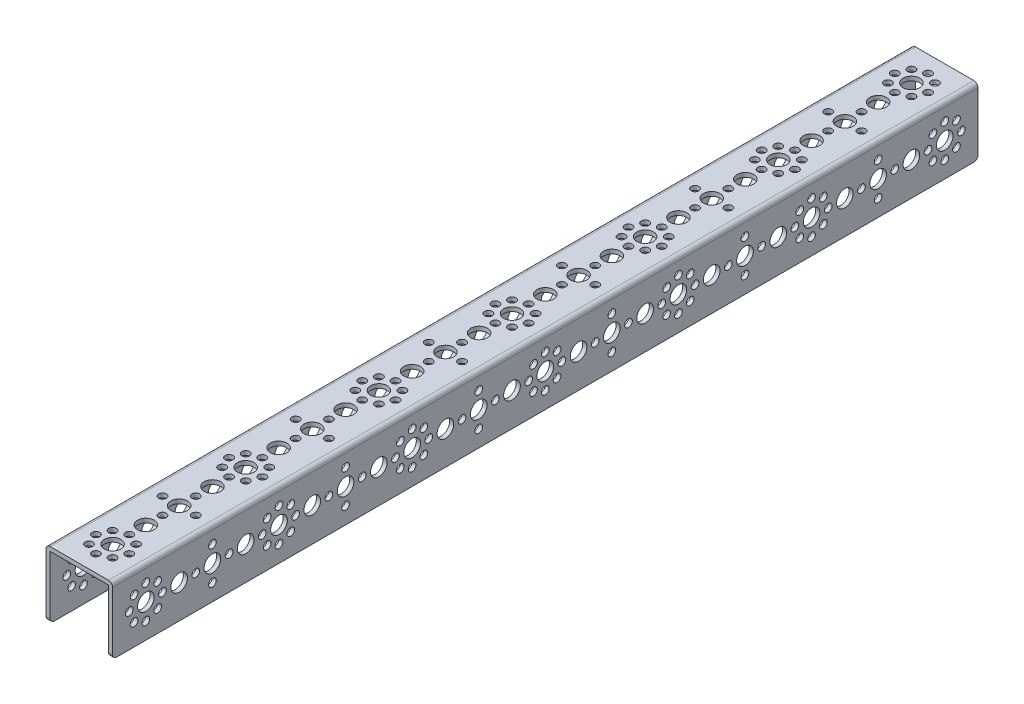
from build123d import *

# Parameters (mm, degrees)
BOSS_EXTRUDE1_DEPTH = 416
SKETCH2_R           = 4
SKETCH2_R_2         = 1.85
CUT_EXTRUDE1_DEPTH  = 418.535627222
SKETCH3_R           = 4
SKETCH3_R_2         = 1.85
CUT_EXTRUDE2_DEPTH  = 418.535627222
FILLET1_R           = 2


with BuildPart() as part:
    # Sketch1 → Boss-Extrude1 (new body)
    with BuildSketch(Plane.XY):
        Polygon((14, -16), (16, -16), (16, 16), (-16, 16), (-16, -16), (-14, -16), (-14, 14), (14, 14), align=None)
    extrude(amount=-BOSS_EXTRUDE1_DEPTH)

    # Sketch2 → Cut-Extrude1 (cut, through all)
    with BuildSketch(Plane(origin=(0, 16, 0), x_dir=(1, 0, 0), z_dir=(0, 1, 0))):
        with Locations(Location((0, 256, 0), (0, 0, 270))):
            Circle(SKETCH2_R)
        with Locations(Location((0, 224, 0), (0, 0, 270))):
            Circle(SKETCH2_R)
        with Locations(Location((0.175415159, 192, 0), (0, 0, 270))):
            Circle(SKETCH2_R)
        with Locations(Location((0, 160, 0), (0, 0, 270))):
            Circle(SKETCH2_R)
        with Locations(Location((0, 240, 0), (0, 0, 270))):
            Circle(SKETCH2_R)
        with Locations(Location((0, 232, 0), (0, 0, 270))):
            Circle(SKETCH2_R_2)
        with Locations(Location((0, 248, 0), (0, 0, 270))):
            Circle(SKETCH2_R_2)
        with Locations(Location((-8, 240, 0), (0, 0, 270))):
            Circle(SKETCH2_R_2)
        with Locations(Location((8, 240, 0), (0, 0, 270))):
            Circle(SKETCH2_R_2)
        with Locations(Location((0, 264, 0), (0, 0, 270))):
            Circle(SKETCH2_R_2)
        with Locations(Location((-8, 272, 0), (0, 0, 270))):
            Circle(SKETCH2_R_2)
        with Locations(Location((0, 272, 0), (0, 0, 270))):
            Circle(SKETCH2_R)
        with Locations(Location((8, 272, 0), (0, 0, 270))):
            Circle(SKETCH2_R_2)
        with Locations(Location((5.66, 277.66, 0), (0, 0, 270))):
            Circle(SKETCH2_R_2)
        with Locations(Location((-5.66, 277.66, 0), (0, 0, 270))):
            Circle(SKETCH2_R_2)
        with Locations(Location((0, 280, 0), (0, 0, 270))):
            Circle(SKETCH2_R_2)
        with Locations(Location((5.66, 266.34, 0), (0, 0, 270))):
            Circle(SKETCH2_R_2)
        with Locations(Location((-5.66, 266.34, 0), (0, 0, 270))):
            Circle(SKETCH2_R_2)
        with Locations(Location((0, 176, 0), (0, 0, 270))):
            Circle(SKETCH2_R)
        with Locations(Location((0, 168, 0), (0, 0, 270))):
            Circle(SKETCH2_R_2)
        with Locations(Location((0, 184, 0), (0, 0, 270))):
            Circle(SKETCH2_R_2)
        with Locations(Location((-8, 176, 0), (0, 0, 270))):
            Circle(SKETCH2_R_2)
        with Locations(Location((8, 176, 0), (0, 0, 270))):
            Circle(SKETCH2_R_2)
        with Locations(Location((0, 200, 0), (0, 0, 270))):
            Circle(SKETCH2_R_2)
        with Locations(Location((-8, 208, 0), (0, 0, 270))):
            Circle(SKETCH2_R_2)
        with Locations(Location((0, 208, 0), (0, 0, 270))):
            Circle(SKETCH2_R)
        with Locations(Location((8, 208, 0), (0, 0, 270))):
            Circle(SKETCH2_R_2)
        with Locations(Location((5.66, 213.66, 0), (0, 0, 270))):
            Circle(SKETCH2_R_2)
        with Locations(Location((-5.66, 213.66, 0), (0, 0, 270))):
            Circle(SKETCH2_R_2)
        with Locations(Location((0, 216, 0), (0, 0, 270))):
            Circle(SKETCH2_R_2)
        with Locations(Location((5.66, 202.34, 0), (0, 0, 270))):
            Circle(SKETCH2_R_2)
        with Locations(Location((-5.66, 202.34, 0), (0, 0, 270))):
            Circle(SKETCH2_R_2)
        with Locations(Location((0, 32, 0), (0, 0, 270))):
            Circle(SKETCH2_R)
        with Locations(Location((0, 64, 0), (0, 0, 270))):
            Circle(SKETCH2_R)
        with Locations(Location((-0.175415159, 96, 0), (0, 0, 270))):
            Circle(SKETCH2_R)
        with Locations(Location((0, 128, 0), (0, 0, 270))):
            Circle(SKETCH2_R)
        with Locations(Location((0, 48, 0), (0, 0, 270))):
            Circle(SKETCH2_R)
        with Locations(Location((0, 56, 0), (0, 0, 270))):
            Circle(SKETCH2_R_2)
        with Locations(Location((0, 40, 0), (0, 0, 270))):
            Circle(SKETCH2_R_2)
        with Locations(Location((8, 48, 0), (0, 0, 270))):
            Circle(SKETCH2_R_2)
        with Locations(Location((-8, 48, 0), (0, 0, 270))):
            Circle(SKETCH2_R_2)
        with Locations(Location((0, 24, 0), (0, 0, 270))):
            Circle(SKETCH2_R_2)
        with Locations(Location((8, 16, 0), (0, 0, 270))):
            Circle(SKETCH2_R_2)
        with Locations(Location((0, 16, 0), (0, 0, 270))):
            Circle(SKETCH2_R)
        with Locations(Location((-8, 16, 0), (0, 0, 270))):
            Circle(SKETCH2_R_2)
        with Locations(Location((-5.66, 10.34, 0), (0, 0, 270))):
            Circle(SKETCH2_R_2)
        with Locations(Location((5.66, 10.34, 0), (0, 0, 270))):
            Circle(SKETCH2_R_2)
        with Locations(Location((0, 8, 0), (0, 0, 270))):
            Circle(SKETCH2_R_2)
        with Locations(Location((-5.66, 21.66, 0), (0, 0, 270))):
            Circle(SKETCH2_R_2)
        with Locations(Location((5.66, 21.66, 0), (0, 0, 270))):
            Circle(SKETCH2_R_2)
        with Locations(Location((0, 112, 0), (0, 0, 270))):
            Circle(SKETCH2_R)
        with Locations(Location((0, 120, 0), (0, 0, 270))):
            Circle(SKETCH2_R_2)
        with Locations(Location((0, 104, 0), (0, 0, 270))):
            Circle(SKETCH2_R_2)
        with Locations(Location((8, 112, 0), (0, 0, 270))):
            Circle(SKETCH2_R_2)
        with Locations(Location((-8, 112, 0), (0, 0, 270))):
            Circle(SKETCH2_R_2)
        with Locations(Location((0, 88, 0), (0, 0, 270))):
            Circle(SKETCH2_R_2)
        with Locations(Location((8, 80, 0), (0, 0, 270))):
            Circle(SKETCH2_R_2)
        with Locations(Location((0, 80, 0), (0, 0, 270))):
            Circle(SKETCH2_R)
        with Locations(Location((-8, 80, 0), (0, 0, 270))):
            Circle(SKETCH2_R_2)
        with Locations(Location((-5.66, 74.34, 0), (0, 0, 270))):
            Circle(SKETCH2_R_2)
        with Locations(Location((5.66, 74.34, 0), (0, 0, 270))):
            Circle(SKETCH2_R_2)
        with Locations(Location((0, 72, 0), (0, 0, 270))):
            Circle(SKETCH2_R_2)
        with Locations(Location((-5.66, 85.66, 0), (0, 0, 270))):
            Circle(SKETCH2_R_2)
        with Locations(Location((5.66, 85.66, 0), (0, 0, 270))):
            Circle(SKETCH2_R_2)
        with Locations(Location((0, 136, 0), (0, 0, 270))):
            Circle(SKETCH2_R_2)
        with Locations(Location((-8, 144, 0), (0, 0, 270))):
            Circle(SKETCH2_R_2)
        with Locations(Location((0, 144, 0), (0, 0, 270))):
            Circle(SKETCH2_R)
        with Locations(Location((8, 144, 0), (0, 0, 270))):
            Circle(SKETCH2_R_2)
        with Locations(Location((5.66, 149.66, 0), (0, 0, 270))):
            Circle(SKETCH2_R_2)
        with Locations(Location((-5.66, 149.66, 0), (0, 0, 270))):
            Circle(SKETCH2_R_2)
        with Locations(Location((0, 152, 0), (0, 0, 270))):
            Circle(SKETCH2_R_2)
        with Locations(Location((5.66, 138.34, 0), (0, 0, 270))):
            Circle(SKETCH2_R_2)
        with Locations(Location((-5.66, 138.34, 0), (0, 0, 270))):
            Circle(SKETCH2_R_2)
        with Locations(Location((0, 384, 0), (0, 0, 270))):
            Circle(SKETCH2_R)
        with Locations(Location((0, 352, 0), (0, 0, 270))):
            Circle(SKETCH2_R)
        with Locations(Location((0.175415159, 320, 0), (0, 0, 270))):
            Circle(SKETCH2_R)
        with Locations(Location((0, 288, 0), (0, 0, 270))):
            Circle(SKETCH2_R)
        with Locations(Location((0, 368, 0), (0, 0, 270))):
            Circle(SKETCH2_R)
        with Locations(Location((0, 360, 0), (0, 0, 270))):
            Circle(SKETCH2_R_2)
        with Locations(Location((0, 376, 0), (0, 0, 270))):
            Circle(SKETCH2_R_2)
        with Locations(Location((-8, 368, 0), (0, 0, 270))):
            Circle(SKETCH2_R_2)
        with Locations(Location((8, 368, 0), (0, 0, 270))):
            Circle(SKETCH2_R_2)
        with Locations(Location((0, 392, 0), (0, 0, 270))):
            Circle(SKETCH2_R_2)
        with Locations(Location((-8, 400, 0), (0, 0, 270))):
            Circle(SKETCH2_R_2)
        with Locations(Location((0, 400, 0), (0, 0, 270))):
            Circle(SKETCH2_R)
        with Locations(Location((8, 400, 0), (0, 0, 270))):
            Circle(SKETCH2_R_2)
        with Locations(Location((5.66, 405.66, 0), (0, 0, 270))):
            Circle(SKETCH2_R_2)
        with Locations(Location((-5.66, 405.66, 0), (0, 0, 270))):
            Circle(SKETCH2_R_2)
        with Locations(Location((0, 408, 0), (0, 0, 270))):
            Circle(SKETCH2_R_2)
        with Locations(Location((5.66, 394.34, 0), (0, 0, 270))):
            Circle(SKETCH2_R_2)
        with Locations(Location((-5.66, 394.34, 0), (0, 0, 270))):
            Circle(SKETCH2_R_2)
        with Locations(Location((0, 304, 0), (0, 0, 270))):
            Circle(SKETCH2_R)
        with Locations(Location((0, 296, 0), (0, 0, 270))):
            Circle(SKETCH2_R_2)
        with Locations(Location((0, 312, 0), (0, 0, 270))):
            Circle(SKETCH2_R_2)
        with Locations(Location((-8, 304, 0), (0, 0, 270))):
            Circle(SKETCH2_R_2)
        with Locations(Location((8, 304, 0), (0, 0, 270))):
            Circle(SKETCH2_R_2)
        with Locations(Location((0, 328, 0), (0, 0, 270))):
            Circle(SKETCH2_R_2)
        with Locations(Location((-8, 336, 0), (0, 0, 270))):
            Circle(SKETCH2_R_2)
        with Locations(Location((0, 336, 0), (0, 0, 270))):
            Circle(SKETCH2_R)
        with Locations(Location((8, 336, 0), (0, 0, 270))):
            Circle(SKETCH2_R_2)
        with Locations(Location((5.66, 341.66, 0), (0, 0, 270))):
            Circle(SKETCH2_R_2)
        with Locations(Location((-5.66, 341.66, 0), (0, 0, 270))):
            Circle(SKETCH2_R_2)
        with Locations(Location((0, 344, 0), (0, 0, 270))):
            Circle(SKETCH2_R_2)
        with Locations(Location((5.66, 330.34, 0), (0, 0, 270))):
            Circle(SKETCH2_R_2)
        with Locations(Location((-5.66, 330.34, 0), (0, 0, 270))):
            Circle(SKETCH2_R_2)
    extrude(amount=-CUT_EXTRUDE1_DEPTH, mode=Mode.SUBTRACT)

    # Sketch3 → Cut-Extrude2 (cut, through all)
    with BuildSketch(Plane(origin=(16, 0, 0), x_dir=(0, 0, -1), z_dir=(1, 0, 0))):
        with Locations(Location((160, 0, 0), (0, 0, 90))):
            Circle(SKETCH3_R)
        with Locations(Location((192, 0, 0), (0, 0, 90))):
            Circle(SKETCH3_R)
        with Locations(Location((224, 0.175415159, 0), (0, 0, 90))):
            Circle(SKETCH3_R)
        with Locations(Location((256, 0, 0), (0, 0, 90))):
            Circle(SKETCH3_R)
        with Locations(Location((176, 0, 0), (0, 0, 90))):
            Circle(SKETCH3_R)
        with Locations(Location((184, 0, 0), (0, 0, 90))):
            Circle(SKETCH3_R_2)
        with Locations(Location((168, 0, 0), (0, 0, 90))):
            Circle(SKETCH3_R_2)
        with Locations(Location((176, -8, 0), (0, 0, 90))):
            Circle(SKETCH3_R_2)
        with Locations(Location((176, 8, 0), (0, 0, 90))):
            Circle(SKETCH3_R_2)
        with Locations(Location((152, 0, 0), (0, 0, 90))):
            Circle(SKETCH3_R_2)
        with Locations(Location((144, -8, 0), (0, 0, 90))):
            Circle(SKETCH3_R_2)
        with Locations(Location((144, 0, 0), (0, 0, 90))):
            Circle(SKETCH3_R)
        with Locations(Location((144, 8, 0), (0, 0, 90))):
            Circle(SKETCH3_R_2)
        with Locations(Location((138.34, 5.66, 0), (0, 0, 90))):
            Circle(SKETCH3_R_2)
        with Locations(Location((138.34, -5.66, 0), (0, 0, 90))):
            Circle(SKETCH3_R_2)
        with Locations(Location((136, 0, 0), (0, 0, 90))):
            Circle(SKETCH3_R_2)
        with Locations(Location((149.66, 5.66, 0), (0, 0, 90))):
            Circle(SKETCH3_R_2)
        with Locations(Location((149.66, -5.66, 0), (0, 0, 90))):
            Circle(SKETCH3_R_2)
        with Locations(Location((240, 0, 0), (0, 0, 90))):
            Circle(SKETCH3_R)
        with Locations(Location((248, 0, 0), (0, 0, 90))):
            Circle(SKETCH3_R_2)
        with Locations(Location((232, 0, 0), (0, 0, 90))):
            Circle(SKETCH3_R_2)
        with Locations(Location((240, -8, 0), (0, 0, 90))):
            Circle(SKETCH3_R_2)
        with Locations(Location((240, 8, 0), (0, 0, 90))):
            Circle(SKETCH3_R_2)
        with Locations(Location((216, 0, 0), (0, 0, 90))):
            Circle(SKETCH3_R_2)
        with Locations(Location((208, -8, 0), (0, 0, 90))):
            Circle(SKETCH3_R_2)
        with Locations(Location((208, 0, 0), (0, 0, 90))):
            Circle(SKETCH3_R)
        with Locations(Location((208, 8, 0), (0, 0, 90))):
            Circle(SKETCH3_R_2)
        with Locations(Location((202.34, 5.66, 0), (0, 0, 90))):
            Circle(SKETCH3_R_2)
        with Locations(Location((202.34, -5.66, 0), (0, 0, 90))):
            Circle(SKETCH3_R_2)
        with Locations(Location((200, 0, 0), (0, 0, 90))):
            Circle(SKETCH3_R_2)
        with Locations(Location((213.66, 5.66, 0), (0, 0, 90))):
            Circle(SKETCH3_R_2)
        with Locations(Location((213.66, -5.66, 0), (0, 0, 90))):
            Circle(SKETCH3_R_2)
        with Locations(Location((384, 0, 0), (0, 0, 90))):
            Circle(SKETCH3_R)
        with Locations(Location((352, 0, 0), (0, 0, 90))):
            Circle(SKETCH3_R)
        with Locations(Location((320, -0.175415159, 0), (0, 0, 90))):
            Circle(SKETCH3_R)
        with Locations(Location((288, 0, 0), (0, 0, 90))):
            Circle(SKETCH3_R)
        with Locations(Location((368, 0, 0), (0, 0, 90))):
            Circle(SKETCH3_R)
        with Locations(Location((360, 0, 0), (0, 0, 90))):
            Circle(SKETCH3_R_2)
        with Locations(Location((376, 0, 0), (0, 0, 90))):
            Circle(SKETCH3_R_2)
        with Locations(Location((368, 8, 0), (0, 0, 90))):
            Circle(SKETCH3_R_2)
        with Locations(Location((368, -8, 0), (0, 0, 90))):
            Circle(SKETCH3_R_2)
        with Locations(Location((392, 0, 0), (0, 0, 90))):
            Circle(SKETCH3_R_2)
        with Locations(Location((400, 8, 0), (0, 0, 90))):
            Circle(SKETCH3_R_2)
        with Locations(Location((400, 0, 0), (0, 0, 90))):
            Circle(SKETCH3_R)
        with Locations(Location((400, -8, 0), (0, 0, 90))):
            Circle(SKETCH3_R_2)
        with Locations(Location((405.66, -5.66, 0), (0, 0, 90))):
            Circle(SKETCH3_R_2)
        with Locations(Location((405.66, 5.66, 0), (0, 0, 90))):
            Circle(SKETCH3_R_2)
        with Locations(Location((408, 0, 0), (0, 0, 90))):
            Circle(SKETCH3_R_2)
        with Locations(Location((394.34, -5.66, 0), (0, 0, 90))):
            Circle(SKETCH3_R_2)
        with Locations(Location((394.34, 5.66, 0), (0, 0, 90))):
            Circle(SKETCH3_R_2)
        with Locations(Location((304, 0, 0), (0, 0, 90))):
            Circle(SKETCH3_R)
        with Locations(Location((296, 0, 0), (0, 0, 90))):
            Circle(SKETCH3_R_2)
        with Locations(Location((312, 0, 0), (0, 0, 90))):
            Circle(SKETCH3_R_2)
        with Locations(Location((304, 8, 0), (0, 0, 90))):
            Circle(SKETCH3_R_2)
        with Locations(Location((304, -8, 0), (0, 0, 90))):
            Circle(SKETCH3_R_2)
        with Locations(Location((328, 0, 0), (0, 0, 90))):
            Circle(SKETCH3_R_2)
        with Locations(Location((336, 8, 0), (0, 0, 90))):
            Circle(SKETCH3_R_2)
        with Locations(Location((336, 0, 0), (0, 0, 90))):
            Circle(SKETCH3_R)
        with Locations(Location((336, -8, 0), (0, 0, 90))):
            Circle(SKETCH3_R_2)
        with Locations(Location((341.66, -5.66, 0), (0, 0, 90))):
            Circle(SKETCH3_R_2)
        with Locations(Location((341.66, 5.66, 0), (0, 0, 90))):
            Circle(SKETCH3_R_2)
        with Locations(Location((344, 0, 0), (0, 0, 90))):
            Circle(SKETCH3_R_2)
        with Locations(Location((330.34, -5.66, 0), (0, 0, 90))):
            Circle(SKETCH3_R_2)
        with Locations(Location((330.34, 5.66, 0), (0, 0, 90))):
            Circle(SKETCH3_R_2)
        with Locations(Location((280, 0, 0), (0, 0, 90))):
            Circle(SKETCH3_R_2)
        with Locations(Location((272, -8, 0), (0, 0, 90))):
            Circle(SKETCH3_R_2)
        with Locations(Location((272, 0, 0), (0, 0, 90))):
            Circle(SKETCH3_R)
        with Locations(Location((272, 8, 0), (0, 0, 90))):
            Circle(SKETCH3_R_2)
        with Locations(Location((266.34, 5.66, 0), (0, 0, 90))):
            Circle(SKETCH3_R_2)
        with Locations(Location((266.34, -5.66, 0), (0, 0, 90))):
            Circle(SKETCH3_R_2)
        with Locations(Location((264, 0, 0), (0, 0, 90))):
            Circle(SKETCH3_R_2)
        with Locations(Location((277.66, 5.66, 0), (0, 0, 90))):
            Circle(SKETCH3_R_2)
        with Locations(Location((277.66, -5.66, 0), (0, 0, 90))):
            Circle(SKETCH3_R_2)
        with Locations(Location((32, 0, 0), (0, 0, 90))):
            Circle(SKETCH3_R)
        with Locations(Location((64, 0, 0), (0, 0, 90))):
            Circle(SKETCH3_R)
        with Locations(Location((96, 0.175415159, 0), (0, 0, 90))):
            Circle(SKETCH3_R)
        with Locations(Location((128, 0, 0), (0, 0, 90))):
            Circle(SKETCH3_R)
        with Locations(Location((48, 0, 0), (0, 0, 90))):
            Circle(SKETCH3_R)
        with Locations(Location((56, 0, 0), (0, 0, 90))):
            Circle(SKETCH3_R_2)
        with Locations(Location((40, 0, 0), (0, 0, 90))):
            Circle(SKETCH3_R_2)
        with Locations(Location((48, -8, 0), (0, 0, 90))):
            Circle(SKETCH3_R_2)
        with Locations(Location((48, 8, 0), (0, 0, 90))):
            Circle(SKETCH3_R_2)
        with Locations(Location((24, 0, 0), (0, 0, 90))):
            Circle(SKETCH3_R_2)
        with Locations(Location((16, -8, 0), (0, 0, 90))):
            Circle(SKETCH3_R_2)
        with Locations(Location((16, 0, 0), (0, 0, 90))):
            Circle(SKETCH3_R)
        with Locations(Location((16, 8, 0), (0, 0, 90))):
            Circle(SKETCH3_R_2)
        with Locations(Location((10.34, 5.66, 0), (0, 0, 90))):
            Circle(SKETCH3_R_2)
        with Locations(Location((10.34, -5.66, 0), (0, 0, 90))):
            Circle(SKETCH3_R_2)
        with Locations(Location((8, 0, 0), (0, 0, 90))):
            Circle(SKETCH3_R_2)
        with Locations(Location((21.66, 5.66, 0), (0, 0, 90))):
            Circle(SKETCH3_R_2)
        with Locations(Location((21.66, -5.66, 0), (0, 0, 90))):
            Circle(SKETCH3_R_2)
        with Locations(Location((112, 0, 0), (0, 0, 90))):
            Circle(SKETCH3_R)
        with Locations(Location((120, 0, 0), (0, 0, 90))):
            Circle(SKETCH3_R_2)
        with Locations(Location((104, 0, 0), (0, 0, 90))):
            Circle(SKETCH3_R_2)
        with Locations(Location((112, -8, 0), (0, 0, 90))):
            Circle(SKETCH3_R_2)
        with Locations(Location((112, 8, 0), (0, 0, 90))):
            Circle(SKETCH3_R_2)
        with Locations(Location((88, 0, 0), (0, 0, 90))):
            Circle(SKETCH3_R_2)
        with Locations(Location((80, -8, 0), (0, 0, 90))):
            Circle(SKETCH3_R_2)
        with Locations(Location((80, 0, 0), (0, 0, 90))):
            Circle(SKETCH3_R)
        with Locations(Location((80, 8, 0), (0, 0, 90))):
            Circle(SKETCH3_R_2)
        with Locations(Location((74.34, 5.66, 0), (0, 0, 90))):
            Circle(SKETCH3_R_2)
        with Locations(Location((74.34, -5.66, 0), (0, 0, 90))):
            Circle(SKETCH3_R_2)
        with Locations(Location((72, 0, 0), (0, 0, 90))):
            Circle(SKETCH3_R_2)
        with Locations(Location((85.66, 5.66, 0), (0, 0, 90))):
            Circle(SKETCH3_R_2)
        with Locations(Location((85.66, -5.66, 0), (0, 0, 90))):
            Circle(SKETCH3_R_2)
    extrude(amount=-CUT_EXTRUDE2_DEPTH, mode=Mode.SUBTRACT)

    # Fillet1
    fillet1_edges = [part.edges().sort_by_distance(p)[0] for p in [
        (-15, -16, -416),
        (-16, 16, -208),
        (16, 16, -208),
        (15, -16, -416),
        (15, -16, 0),
        (-15, -16, 0),
    ]]
    fillet(fillet1_edges, radius=FILLET1_R)


solid = part.part
